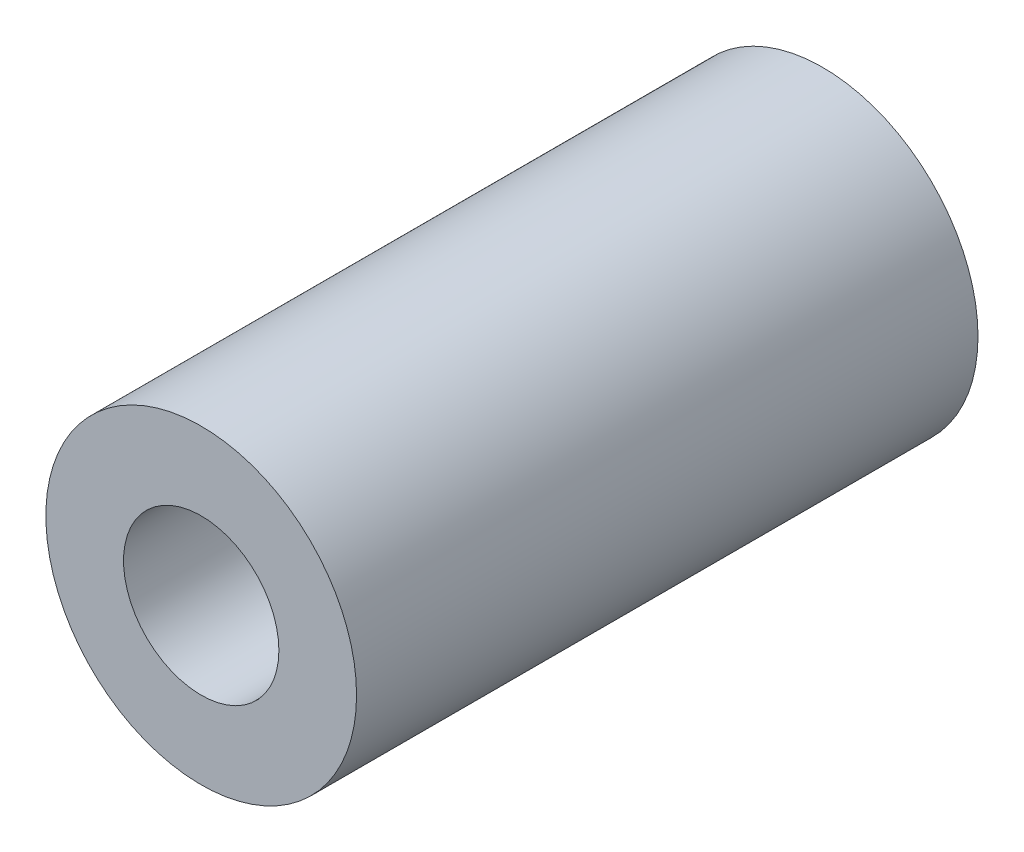
from build123d import *

# Parameters (mm, degrees)
SKETCH1_R           = 5.08
SKETCH1_R_2         = 2.54
BOSS_EXTRUDE1_DEPTH = 20.32


with BuildPart() as part:
    # Sketch1 → Boss-Extrude1 (new body)
    with BuildSketch(Plane(origin=(0, 0, 0), x_dir=(0, 1, 0), z_dir=(0, 0, 1))):
        with Locations(Location((0, 0, 0), (0, 0, 270))):
            Circle(SKETCH1_R)
        with Locations(Location((0, 0, 0), (0, 0, 270))):
            Circle(SKETCH1_R_2, mode=Mode.SUBTRACT)
    extrude(amount=BOSS_EXTRUDE1_DEPTH)


solid = part.part
